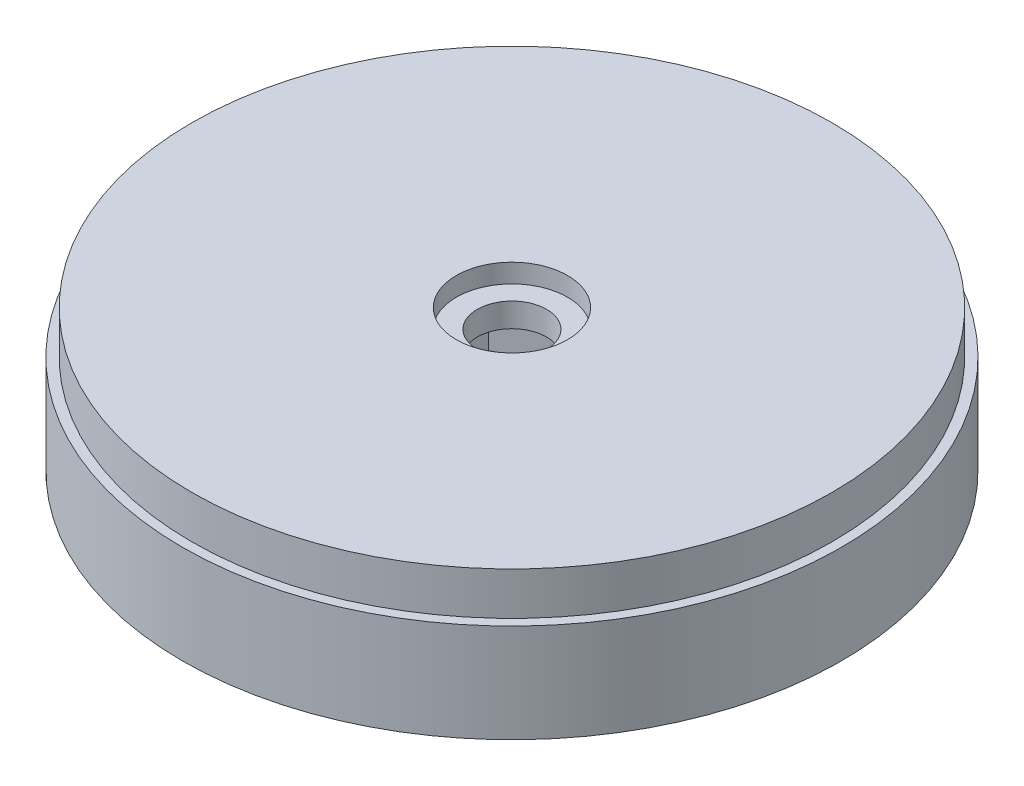
from build123d import *

# Parameters (mm, degrees)
SKETCH1_R           = 38.5
BOSS_EXTRUDE1_DEPTH = 11.5
SKETCH2_R           = 37.4
SKETCH2_R_2         = 4.05
BOSS_EXTRUDE2_DEPTH = 5
SKETCH3_R           = 8
CUT_EXTRUDE1_DEPTH  = 7
SKETCH4_R           = 6.5
CUT_EXTRUDE2_DEPTH  = 2.2


with BuildPart() as part:
    # Sketch1 → Boss-Extrude1 (new body)
    with BuildSketch(Plane(origin=(0, 0, 0), x_dir=(1, 0, 0), z_dir=(0, 1, 0))):
        with Locations(Location((0, 0, 0), (0, 0, 270))):
            Circle(SKETCH1_R)
        Polygon((0, 7.505553499), (-6.5, 3.75277675), (-6.5, -3.75277675), (0, -7.505553499), (6.5, -3.75277675), (6.5, 3.75277675), align=None, mode=Mode.SUBTRACT)
    extrude(amount=BOSS_EXTRUDE1_DEPTH)

    # Sketch2 → Boss-Extrude2 (add)
    with BuildSketch(Plane(origin=(0, 11.5, 0), x_dir=(1, 0, 0), z_dir=(0, 1, 0))):
        with Locations(Location((0, 0, 0), (0, 0, 270))):
            Circle(SKETCH2_R)
        with Locations(Location((0, 0, 0), (0, 0, 270))):
            Circle(SKETCH2_R_2, mode=Mode.SUBTRACT)
    extrude(amount=BOSS_EXTRUDE2_DEPTH)

    # Sketch3 → Cut-Extrude1 (cut)
    with BuildSketch(Plane.XZ):
        with Locations(Location((0, 0, 0), (0, 0, 270))):
            Circle(SKETCH3_R)
    extrude(amount=-CUT_EXTRUDE1_DEPTH, mode=Mode.SUBTRACT)

    # Sketch4 → Cut-Extrude2 (cut)
    with BuildSketch(Plane(origin=(0, 16.5, 0), x_dir=(1, 0, 0), z_dir=(0, 1, 0))):
        with Locations(Location((0, 0, 0), (0, 0, 270))):
            Circle(SKETCH4_R)
    extrude(amount=-CUT_EXTRUDE2_DEPTH, mode=Mode.SUBTRACT)


solid = part.part
